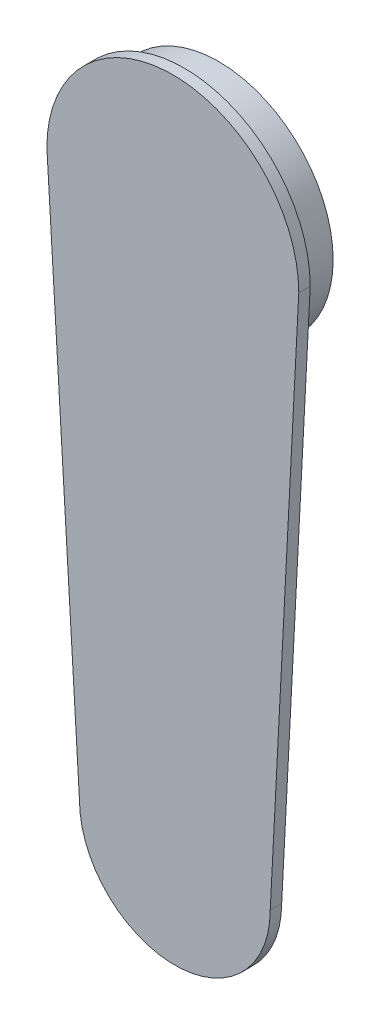
from build123d import *

# Parameters (mm, degrees)
BOSS_EXTRUDE1_DEPTH      = 5
BOSS_EXTRUDE1_DEPTH_BACK = 0.0001
SKETCH2_R                = 50
BOSS_EXTRUDE2_DEPTH      = 15


with BuildPart() as part:
    # Sketch1 → Boss-Extrude1 (new, two sides: drawn at the far end of the back side and taken through both)
    with BuildSketch(Plane.XY.offset(-BOSS_EXTRUDE1_DEPTH_BACK)):
        with BuildLine():
            ThreePointArc((55, 0), (0, 55), (-55, 0))
            Line((-55, 0), (-40.768073077, -239.675921097))
            ThreePointArc((-40.768073077, -239.675921097), (0.881926923, -281.325921097), (42.531926923, -239.675921097))
            Line((42.531926923, -239.675921097), (55, 0))
        make_face()
    extrude(amount=BOSS_EXTRUDE1_DEPTH + BOSS_EXTRUDE1_DEPTH_BACK)

    # Sketch2 → Boss-Extrude2 (add)
    with BuildSketch(Plane(origin=(0, 0, -0.0001), x_dir=(-1, 0, 0), z_dir=(0, 0, -1))):
        with Locations(Location((0, 0, 0), (0, 0, 180))):
            Circle(SKETCH2_R)
    extrude(amount=BOSS_EXTRUDE2_DEPTH)


solid = part.part
